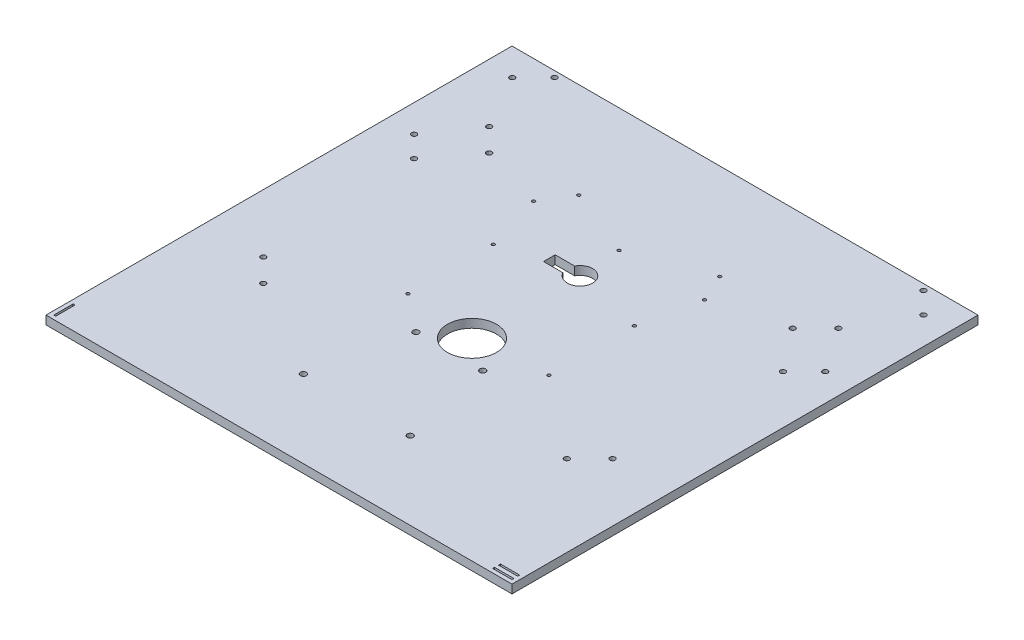
from build123d import *

# Parameters (mm, degrees)
SKETCH1_W           = 304.8
SKETCH1_H           = 304.8
SKETCH1_R           = 16.002
SKETCH1_R_2         = 1.700000004
SKETCH1_R_3         = 1.960000017
SKETCH1_R_4         = 1.959999992
SKETCH1_R_5         = 1.016
SKETCH1_W_2         = 1.270000025
SKETCH1_H_2         = 12.700000025
SKETCH1_W_3         = 12.700000025
SKETCH1_H_3         = 1.270000025
BOSS_EXTRUDE1_DEPTH = 5.588


with BuildPart() as part:
    # Sketch1 → Boss-Extrude1 (new body)
    with BuildSketch(Plane.XZ):
        with Locations((152.4, -152.4)):
            Rectangle(SKETCH1_W, SKETCH1_H)
        with Locations(Location((152.4799846, -126.1262654, 0), (0, 0, 90))):
            Circle(SKETCH1_R, mode=Mode.SUBTRACT)
        with Locations(Location((31.75, -300.832130008, 0), (0, 0, 90))):
            Circle(SKETCH1_R_2, mode=Mode.SUBTRACT)
        with Locations(Location((17.93875, -287.020880008, 0), (0, 0, 90))):
            Circle(SKETCH1_R_2, mode=Mode.SUBTRACT)
        with Locations(Location((273.05, -300.832130008, 0), (0, 0, 90))):
            Circle(SKETCH1_R_2, mode=Mode.SUBTRACT)
        with Locations(Location((286.86125, -287.020880008, 0), (0, 0, 90))):
            Circle(SKETCH1_R_2, mode=Mode.SUBTRACT)
        with Locations(Location((286.86125, -222.781740008, 0), (0, 0, 90))):
            Circle(SKETCH1_R_2, mode=Mode.SUBTRACT)
        with Locations(Location((273.05, -208.970490008, 0), (0, 0, 90))):
            Circle(SKETCH1_R_2, mode=Mode.SUBTRACT)
        with Locations(Location((31.75, -208.970490008, 0), (0, 0, 90))):
            Circle(SKETCH1_R_2, mode=Mode.SUBTRACT)
        with Locations(Location((17.93875, -222.781740008, 0), (0, 0, 90))):
            Circle(SKETCH1_R_2, mode=Mode.SUBTRACT)
        with Locations(Location((38.1787654, -103.9330154, 0), (0, 0, 90))):
            Circle(SKETCH1_R_2, mode=Mode.SUBTRACT)
        with Locations(Location((53.1330154, -88.9787654, 0), (0, 0, 90))):
            Circle(SKETCH1_R_2, mode=Mode.SUBTRACT)
        with Locations(Location((251.6669846, -88.9787654, 0), (0, 0, 90))):
            Circle(SKETCH1_R_2, mode=Mode.SUBTRACT)
        with Locations(Location((266.6212346, -103.9330154, 0), (0, 0, 90))):
            Circle(SKETCH1_R_2, mode=Mode.SUBTRACT)
        with Locations(Location((266.6212346, -251.6669846, 0), (0, 0, 90))):
            Circle(SKETCH1_R_2, mode=Mode.SUBTRACT)
        with Locations(Location((251.6669846, -236.7127346, 0), (0, 0, 90))):
            Circle(SKETCH1_R_2, mode=Mode.SUBTRACT)
        with Locations(Location((53.1330154, -236.7127346, 0), (0, 0, 90))):
            Circle(SKETCH1_R_2, mode=Mode.SUBTRACT)
        with Locations(Location((38.1787654, -251.6669846, 0), (0, 0, 90))):
            Circle(SKETCH1_R_2, mode=Mode.SUBTRACT)
        with Locations(Location((130.6518596, -111.328047498, 0), (0, 0, 90))):
            Circle(SKETCH1_R_3, mode=Mode.SUBTRACT)
        with Locations(Location((174.3081096, -111.328047498, 0), (0, 0, 90))):
            Circle(SKETCH1_R_3, mode=Mode.SUBTRACT)
        with Locations(Location((187.4049846, -50.821596477, 0), (0, 0, 90))):
            Circle(SKETCH1_R_4, mode=Mode.SUBTRACT)
        with Locations(Location((117.5549846, -50.821596477, 0), (0, 0, 90))):
            Circle(SKETCH1_R_4, mode=Mode.SUBTRACT)
        with Locations(Location((206.699984593, -223.995015408, 0), (0, 0, 90))):
            Circle(SKETCH1_R_5, mode=Mode.SUBTRACT)
        with Locations(Location((150.819984593, -223.995015408, 0), (0, 0, 90))):
            Circle(SKETCH1_R_5, mode=Mode.SUBTRACT)
        with Locations(Location((94.939984593, -223.995015408, 0), (0, 0, 90))):
            Circle(SKETCH1_R_5, mode=Mode.SUBTRACT)
        with Locations(Location((106.299999998, -242.179999993, 0), (0, 0, 90))):
            Circle(SKETCH1_R_5, mode=Mode.SUBTRACT)
        with Locations(Location((106.299999998, -186.299999993, 0), (0, 0, 90))):
            Circle(SKETCH1_R_5, mode=Mode.SUBTRACT)
        with Locations(Location((106.299999998, -130.419999993, 0), (0, 0, 90))):
            Circle(SKETCH1_R_5, mode=Mode.SUBTRACT)
        with Locations(Location((198.500000002, -130.419999993, 0), (0, 0, 90))):
            Circle(SKETCH1_R_5, mode=Mode.SUBTRACT)
        with Locations(Location((198.500000002, -186.299999993, 0), (0, 0, 90))):
            Circle(SKETCH1_R_5, mode=Mode.SUBTRACT)
        with Locations(Location((198.500000002, -242.179999993, 0), (0, 0, 90))):
            Circle(SKETCH1_R_5, mode=Mode.SUBTRACT)
        with Locations((3.174999988, -8.889999987)):
            Rectangle(SKETCH1_W_2, SKETCH1_H_2, mode=Mode.SUBTRACT)
        with Locations((295.910000013, -3.174999988)):
            Rectangle(SKETCH1_W_3, SKETCH1_H_3, mode=Mode.SUBTRACT)
        with Locations((295.910000013, -6.984999988)):
            Rectangle(SKETCH1_W_3, SKETCH1_H_3, mode=Mode.SUBTRACT)
        with BuildLine():
            Line((132.376822673, -200.659999898), (132.376822673, -193.039999899))
            Line((132.376822673, -193.039999899), (145.076822777, -193.039999899))
            ThreePointArc((145.076822777, -193.039999899), (160.655, -196.850000007), (145.076822724, -200.659999898))
            Line((145.076822724, -200.659999898), (132.376822673, -200.659999898))
        make_face(mode=Mode.SUBTRACT)
    extrude(amount=-BOSS_EXTRUDE1_DEPTH)


solid = part.part
